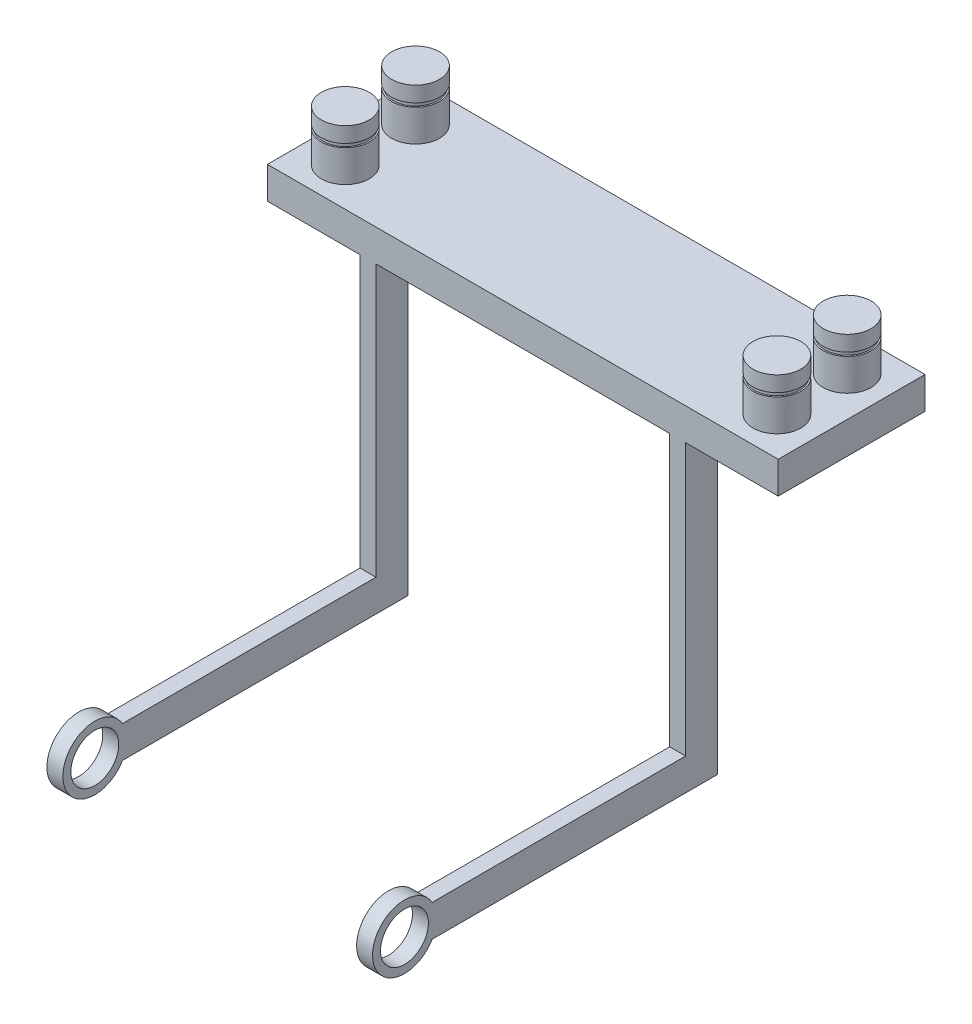
from build123d import *

# Parameters (mm, degrees)
SKETCH2_W           = 50.8
SKETCH2_H           = 29.21
BOSS_EXTRUDE1_DEPTH = 6.35
SKETCH4_R           = 4.7625
BOSS_EXTRUDE2_DEPTH = 6.35
SKETCH7_R           = 4.4704
BOSS_EXTRUDE3_DEPTH = 0.7366
SKETCH8_R           = 4.7625
BOSS_EXTRUDE4_DEPTH = 3.0734
SKETCH11_W          = 3.175
SKETCH11_H          = 6.35
BOSS_EXTRUDE5_DEPTH = 60.325
SKETCH12_W          = 3.175
SKETCH12_H          = 6.35
BOSS_EXTRUDE6_DEPTH = 55.91937
SKETCH13_R          = 6.35
SKETCH13_R_2        = 4.7625
BOSS_EXTRUDE8_DEPTH = 3.175
SKETCH17_R          = 4.7625
CUT_EXTRUDE3_DEPTH  = 3.175


with BuildPart() as part:
    # Sketch2 → Boss-Extrude1 (new body)
    with BuildSketch(Plane(origin=(0, 0, 0), x_dir=(1, 0, 0), z_dir=(0, 1, 0))):
        with Locations((25.4, 14.605)):
            Rectangle(SKETCH2_W, SKETCH2_H)
    boss_extrude1 = extrude(amount=BOSS_EXTRUDE1_DEPTH)

    # Sketch4 → Boss-Extrude2 (add)
    with BuildSketch(Plane(origin=(0, 6.35, 0), x_dir=(1, 0, 0), z_dir=(0, 1, 0))):
        with Locations(Location((42.926, 7.62, 0), (0, 0, 90))):
            Circle(SKETCH4_R)
        with Locations(Location((42.926, 21.59, 0), (0, 0, 90))):
            Circle(SKETCH4_R)
    boss_extrude2 = extrude(amount=BOSS_EXTRUDE2_DEPTH)

    # Sketch7 → Boss-Extrude3 (add)
    with BuildSketch(Plane(origin=(0, 12.7, 0), x_dir=(1, 0, 0), z_dir=(0, 1, 0))):
        with Locations(Location((42.926, 21.59, 0), (0, 0, 270))):
            Circle(SKETCH7_R)
        with Locations(Location((42.926, 7.62, 0), (0, 0, 270))):
            Circle(SKETCH7_R)
    boss_extrude3 = extrude(amount=BOSS_EXTRUDE3_DEPTH)

    # Sketch8 → Boss-Extrude4 (add)
    with BuildSketch(Plane(origin=(0, 13.4366, 0), x_dir=(1, 0, 0), z_dir=(0, 1, 0))):
        with Locations(Location((42.926, 21.59, 0), (0, 0, 90))):
            Circle(SKETCH8_R)
        with Locations(Location((42.926, 7.62, 0), (0, 0, 90))):
            Circle(SKETCH8_R)
    boss_extrude4 = extrude(amount=BOSS_EXTRUDE4_DEPTH)

    # Sketch11 → Boss-Extrude5 (add)
    with BuildSketch(Plane.XZ):
        with Locations((30.7975, -3.175)):
            Rectangle(SKETCH11_W, SKETCH11_H)
    boss_extrude5 = extrude(amount=BOSS_EXTRUDE5_DEPTH)

    # Sketch12 → Boss-Extrude6 (add)
    with BuildSketch(Plane.XY):
        with Locations((30.7975, -57.15)):
            Rectangle(SKETCH12_W, SKETCH12_H)
    boss_extrude6 = extrude(amount=BOSS_EXTRUDE6_DEPTH)

    # Sketch13 → Boss-Extrude8 (add)
    with BuildSketch(Plane.ZY.offset(-29.21)):
        with Locations((55.91937, -57.15)):
            Circle(SKETCH13_R)
        with Locations((55.91937, -57.15)):
            Circle(SKETCH13_R_2, mode=Mode.SUBTRACT)
    boss_extrude8 = extrude(amount=-BOSS_EXTRUDE8_DEPTH)

    # Sketch17 → Cut-Extrude3 (cut)
    with BuildSketch(Plane.ZY.offset(-29.21)):
        with Locations((55.91937, -57.15)):
            Circle(SKETCH17_R)
    cut_extrude3 = extrude(amount=-CUT_EXTRUDE3_DEPTH, mode=Mode.SUBTRACT)

    # Mirror3: Boss-Extrude1, Boss-Extrude2, Boss-Extrude3, Boss-Extrude4, Boss-Extrude5, Boss-Extrude6, Boss-Extrude8, Cut-Extrude3 across plane
    add(boss_extrude1.mirror(Plane(origin=(0, 0, 0), x_dir=(0, 0, 1), z_dir=(1, 0, 0))))
    add(boss_extrude2.mirror(Plane(origin=(0, 0, 0), x_dir=(0, 0, 1), z_dir=(1, 0, 0))))
    add(boss_extrude3.mirror(Plane(origin=(0, 0, 0), x_dir=(0, 0, 1), z_dir=(1, 0, 0))))
    add(boss_extrude4.mirror(Plane(origin=(0, 0, 0), x_dir=(0, 0, 1), z_dir=(1, 0, 0))))
    add(boss_extrude5.mirror(Plane(origin=(0, 0, 0), x_dir=(0, 0, 1), z_dir=(1, 0, 0))))
    add(boss_extrude6.mirror(Plane(origin=(0, 0, 0), x_dir=(0, 0, 1), z_dir=(1, 0, 0))))
    add(boss_extrude8.mirror(Plane(origin=(0, 0, 0), x_dir=(0, 0, 1), z_dir=(1, 0, 0))))
    add(cut_extrude3.mirror(Plane(origin=(0, 0, 0), x_dir=(0, 0, 1), z_dir=(1, 0, 0))), mode=Mode.SUBTRACT)


solid = part.part
